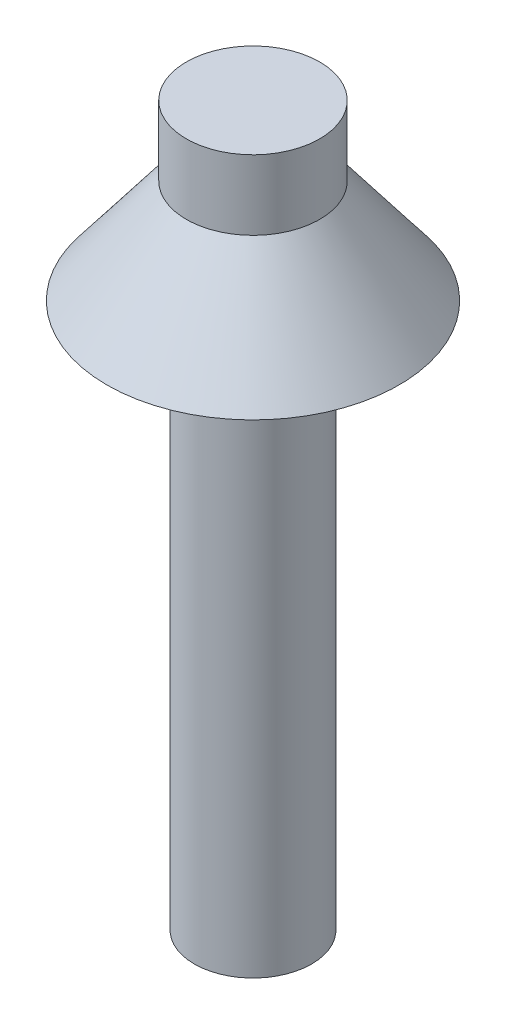
from build123d import *

# Parameters (mm, degrees)
SCHIZZO2_R                   = 30
ESTRUSIONE_ESTRUSIONE1_DEPTH = 319


with BuildPart() as part:
    # Schizzo2 → Estrusione-Estrusione1 (new body)
    with BuildSketch(Plane(origin=(0, 0, 0), x_dir=(1, 0, 0), z_dir=(0, 1, 0))):
        with Locations(Location((0, 0, 0), (0, 0, 270))):
            Circle(SCHIZZO2_R)
    extrude(amount=ESTRUSIONE_ESTRUSIONE1_DEPTH)

    # Schizzo4 → Rivoluzione1 (revolve)
    with BuildSketch(Plane.XY, mode=Mode.PRIVATE) as rivoluzione1_sk:
        Polygon((0, 367.659164194), (34.108689773, 367.659164194), (34.108689773, 331.961419561), (74.759051601, 278.939208481), (0, 278.939208481), align=None)
    revolve(rivoluzione1_sk.sketch.rotate(Axis((0, 278.939208481, 0), (0, 1, 0)), 90), axis=Axis((0, 278.939208481, 0), (0, 1, 0)))


solid = part.part
